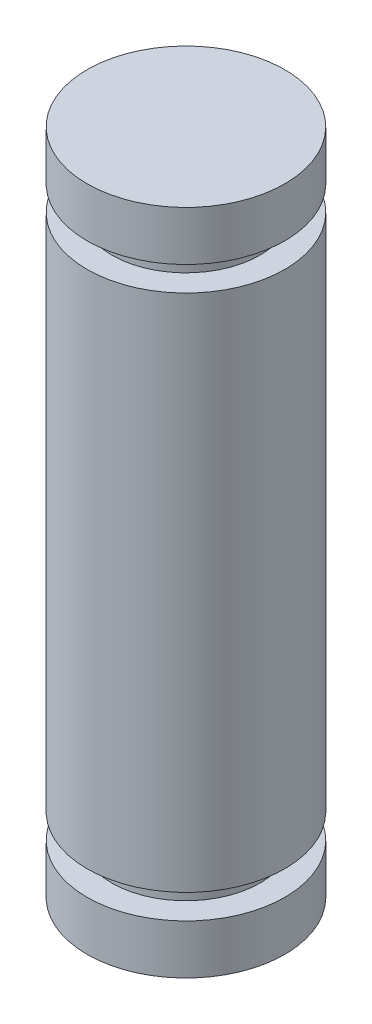
from build123d import *

# Parameters (mm, degrees)
SKETCH1_R           = 4
BOSS_EXTRUDE1_DEPTH = 27
CUT_EXTRUDE1_START  = -3
SKETCH2_R           = 4
SKETCH2_R_2         = 3
CUT_EXTRUDE1_DEPTH  = 1
CUT_EXTRUDE2_START  = -25
SKETCH2_2_R         = 4
SKETCH2_2_R_2       = 3
CUT_EXTRUDE2_DEPTH  = 1


with BuildPart() as part:
    # Sketch1 → Boss-Extrude1 (new body)
    with BuildSketch(Plane(origin=(0, 0, 0), x_dir=(1, 0, 0), z_dir=(0, 1, 0))):
        Circle(SKETCH1_R)
    extrude(amount=BOSS_EXTRUDE1_DEPTH)

    # Sketch2 → Cut-Extrude1 (cut)
    with BuildSketch(Plane(origin=(0, 27, 0), x_dir=(1, 0, 0), z_dir=(0, 1, 0)).offset(CUT_EXTRUDE1_START)):
        Circle(SKETCH2_R)
        Circle(SKETCH2_R_2, mode=Mode.SUBTRACT)
    extrude(amount=CUT_EXTRUDE1_DEPTH, mode=Mode.SUBTRACT)

    # Sketch2<2> → Cut-Extrude2 (cut)
    with BuildSketch(Plane(origin=(0, 27, 0), x_dir=(1, 0, 0), z_dir=(0, 1, 0)).offset(CUT_EXTRUDE2_START)):
        Circle(SKETCH2_2_R)
        Circle(SKETCH2_2_R_2, mode=Mode.SUBTRACT)
    extrude(amount=CUT_EXTRUDE2_DEPTH, mode=Mode.SUBTRACT)


solid = part.part
